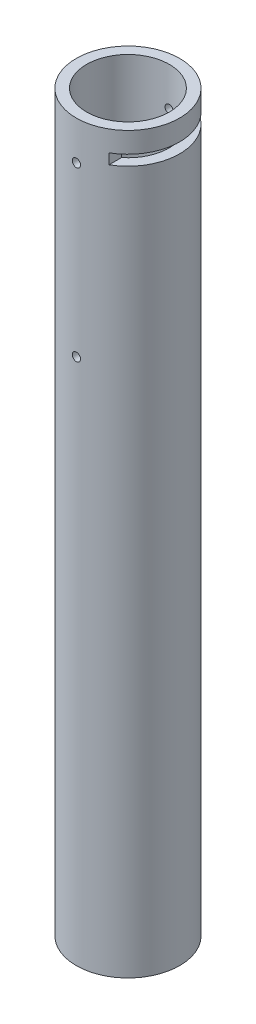
from build123d import *

# Parameters (mm, degrees)
SKETCH1_R               = 31.75
SKETCH1_R_2             = 25.4
BOSS_EXTRUDE1_DEPTH     = 450.85
CUT_EXTRUDE2_DEPTH      = 454.080398495
CUT_EXTRUDE2_DEPTH_BACK = 454.080398495
SKETCH4_R               = 2.54
SKETCH4_W               = 15.875
SKETCH4_H               = 6.35


with BuildPart() as part:
    # Sketch1 → Boss-Extrude1 (new body)
    with BuildSketch(Plane(origin=(0, 0, 0), x_dir=(1, 0, 0), z_dir=(0, 1, 0))):
        with Locations(Location((0, 0, 0), (0, 0, 90))):
            Circle(SKETCH1_R)
        with Locations(Location((0, 0, 0), (0, 0, 90))):
            Circle(SKETCH1_R_2, mode=Mode.SUBTRACT)
    extrude(amount=BOSS_EXTRUDE1_DEPTH)

    # Sketch4 → Cut-Extrude2 (cut, two sides: drawn at the far end of the back side and taken through both)
    with BuildSketch(Plane.XY.offset(-CUT_EXTRUDE2_DEPTH_BACK)):
        with Locations((0, 323.85)):
            Circle(SKETCH4_R)
        with Locations((0, 427.0375)):
            Circle(SKETCH4_R)
        with Locations((23.8125, 434.975)):
            Rectangle(SKETCH4_W, SKETCH4_H)
    extrude(amount=CUT_EXTRUDE2_DEPTH + CUT_EXTRUDE2_DEPTH_BACK, mode=Mode.SUBTRACT)


solid = part.part
